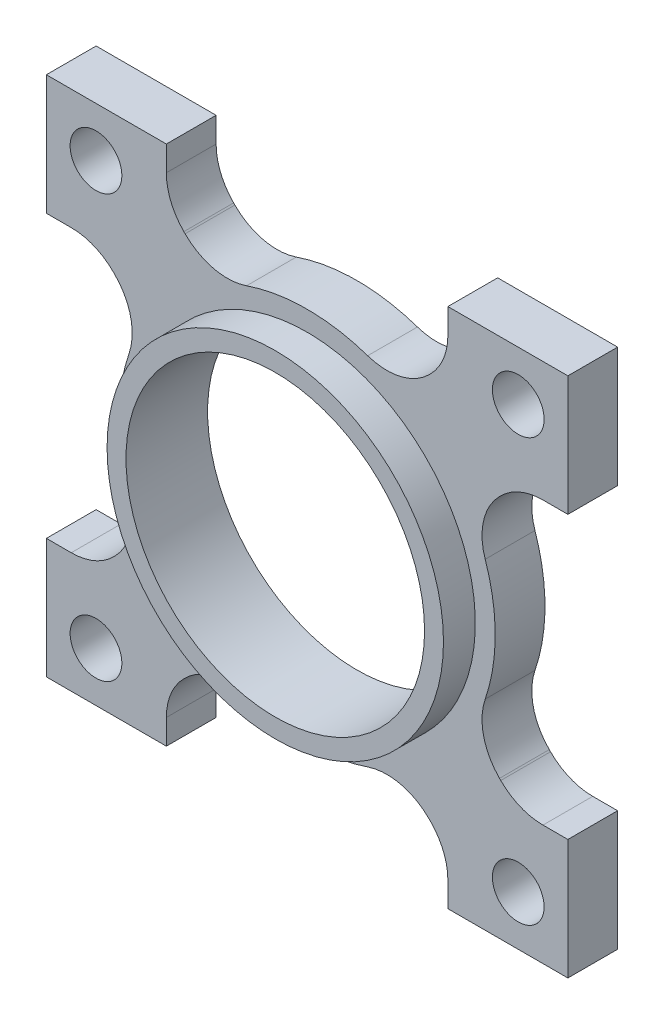
from build123d import *

# Parameters (mm, degrees)
SKETCH3_W           = 33.274
SKETCH3_H           = 33.274
SKETCH3_R           = 9.525
SKETCH3_R_2         = 1.651
BOSS_EXTRUDE1_DEPTH = 3.175
CUT_EXTRUDE1_DEPTH  = 24.741528236
SKETCH5_R           = 10.7315
SKETCH5_R_2         = 9.525
BOSS_EXTRUDE2_DEPTH = 2.032
FILLET1_R           = 3.81


with BuildPart() as part:
    # Sketch3 → Boss-Extrude1 (new body)
    with BuildSketch(Plane.XY):
        Rectangle(SKETCH3_W, SKETCH3_H)
        Circle(SKETCH3_R, mode=Mode.SUBTRACT)
        with Locations((-13.47089, 13.47089)):
            Circle(SKETCH3_R_2, mode=Mode.SUBTRACT)
        with Locations((-13.47089, -13.47089)):
            Circle(SKETCH3_R_2, mode=Mode.SUBTRACT)
        with Locations((13.47089, 13.47089)):
            Circle(SKETCH3_R_2, mode=Mode.SUBTRACT)
        with Locations((13.47089, -13.47089)):
            Circle(SKETCH3_R_2, mode=Mode.SUBTRACT)
    extrude(amount=BOSS_EXTRUDE1_DEPTH)

    # Sketch4 → Cut-Extrude1 (cut, through all)
    with BuildSketch(Plane.XY.offset(3.175)):
        with BuildLine():
            Line((-8.980761939, 16.637), (-8.980761939, 13.47089))
            Line((-8.980761939, 13.47089), (-5.938925744, 10.429053805))
            ThreePointArc((-5.938925744, 10.429053805), (0, 12.0015), (5.938925744, 10.429053805))
            Line((5.938925744, 10.429053805), (8.980761939, 13.47089))
            Line((8.980761939, 13.47089), (8.980761939, 16.637))
            Line((8.980761939, 16.637), (-8.980761939, 16.637))
        make_face()
        with BuildLine():
            Line((-16.637, 8.980761939), (-13.47089, 8.980761939))
            Line((-13.47089, 8.980761939), (-10.429053805, 5.938925744))
            ThreePointArc((-10.429053805, 5.938925744), (-12.0015, 0), (-10.429053805, -5.938925744))
            Line((-10.429053805, -5.938925744), (-13.47089, -8.980761939))
            Line((-13.47089, -8.980761939), (-16.637, -8.980761939))
            Line((-16.637, -8.980761939), (-16.637, 8.980761939))
        make_face()
        with BuildLine():
            Line((-8.980761939, -16.637), (-8.980761939, -13.47089))
            Line((-8.980761939, -13.47089), (-5.938925744, -10.429053805))
            ThreePointArc((-5.938925744, -10.429053805), (0, -12.0015), (5.938925744, -10.429053805))
            Line((5.938925744, -10.429053805), (8.980761939, -13.47089))
            Line((8.980761939, -13.47089), (8.980761939, -16.637))
            Line((8.980761939, -16.637), (-8.980761939, -16.637))
        make_face()
        with BuildLine():
            Line((16.637, -8.980761939), (13.47089, -8.980761939))
            Line((13.47089, -8.980761939), (10.429053805, -5.938925744))
            ThreePointArc((10.429053805, -5.938925744), (12.0015, 0), (10.429053805, 5.938925744))
            Line((10.429053805, 5.938925744), (13.47089, 8.980761939))
            Line((13.47089, 8.980761939), (16.637, 8.980761939))
            Line((16.637, 8.980761939), (16.637, -8.980761939))
        make_face()
    extrude(amount=-CUT_EXTRUDE1_DEPTH, mode=Mode.SUBTRACT)

    # Sketch5 → Boss-Extrude2 (add)
    with BuildSketch(Plane.XY.offset(3.175)):
        with Locations(Location((0, 0, 0), (0, 0, 180))):
            Circle(SKETCH5_R)
        Circle(SKETCH5_R_2, mode=Mode.SUBTRACT)
    extrude(amount=BOSS_EXTRUDE2_DEPTH)

    # Fillet1
    fillet1_edges = [part.edges().sort_by_distance(p)[0] for p in [
        (8.980761939, 13.47089, 1.5875),
        (5.938925744, 10.429053805, 1.5875),
        (-5.938925744, 10.429053805, 1.5875),
        (-8.980761939, 13.47089, 1.5875),
        (-13.47089, 8.980761939, 1.5875),
        (-10.429053805, 5.938925744, 1.5875),
        (-10.429053805, -5.938925744, 1.5875),
        (-13.47089, -8.980761939, 1.5875),
        (-8.980761939, -13.47089, 1.5875),
        (-5.938925744, -10.429053805, 1.5875),
        (5.938925744, -10.429053805, 1.5875),
        (8.980761939, -13.47089, 1.5875),
        (13.47089, -8.980761939, 1.5875),
        (10.429053805, -5.938925744, 1.5875),
        (10.429053805, 5.938925744, 1.5875),
        (13.47089, 8.980761939, 1.5875),
    ]]
    fillet(fillet1_edges, radius=FILLET1_R)


solid = part.part
